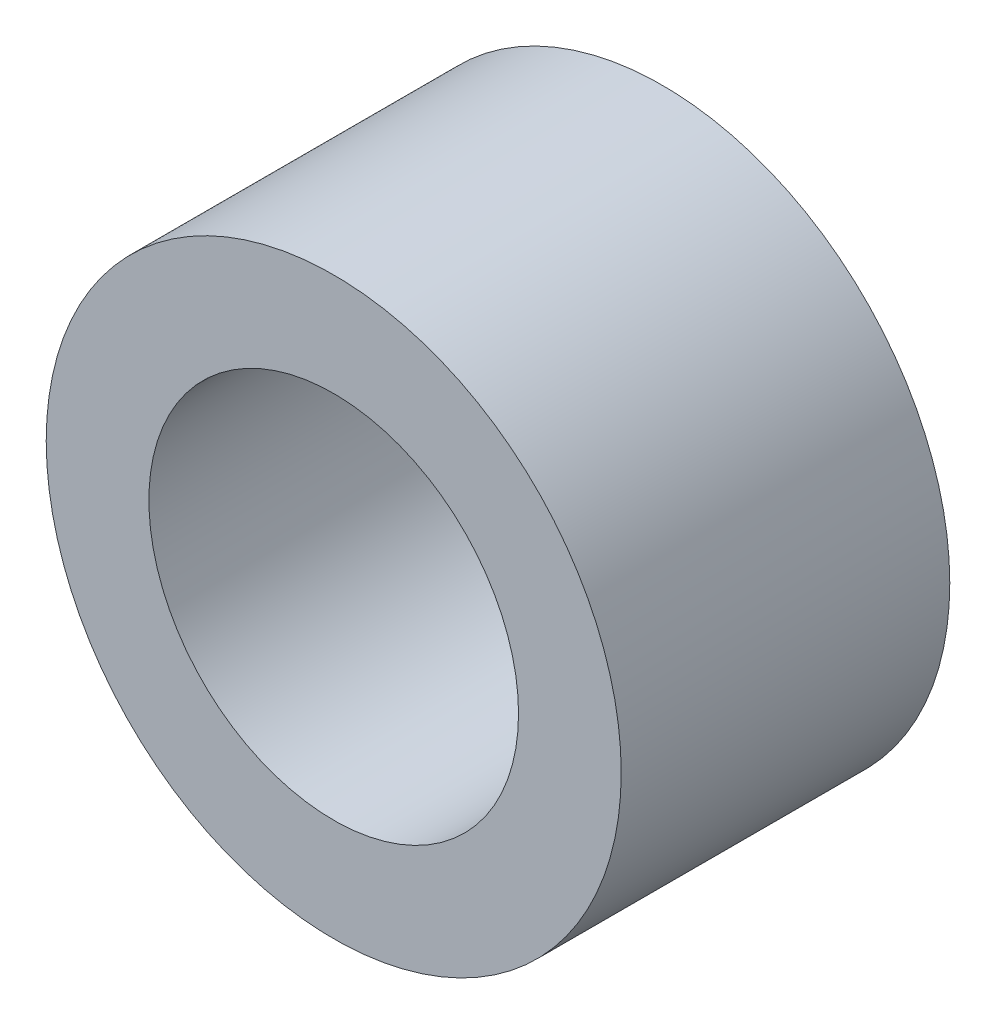
from build123d import *

# Parameters (mm, degrees)
SKETCH1_R           = 3.5
BOSS_EXTRUDE1_DEPTH = 4
SKETCH11_R          = 2.25
CUT_EXTRUDE1_DEPTH  = 4


with BuildPart() as part:
    # Sketch1 → Boss-Extrude1 (new body)
    with BuildSketch(Plane.XY):
        Circle(SKETCH1_R)
    extrude(amount=-BOSS_EXTRUDE1_DEPTH)

    # Sketch11 → Cut-Extrude1 (cut)
    with BuildSketch(Plane.XY):
        Circle(SKETCH11_R)
    extrude(amount=-CUT_EXTRUDE1_DEPTH, mode=Mode.SUBTRACT)


solid = part.part
